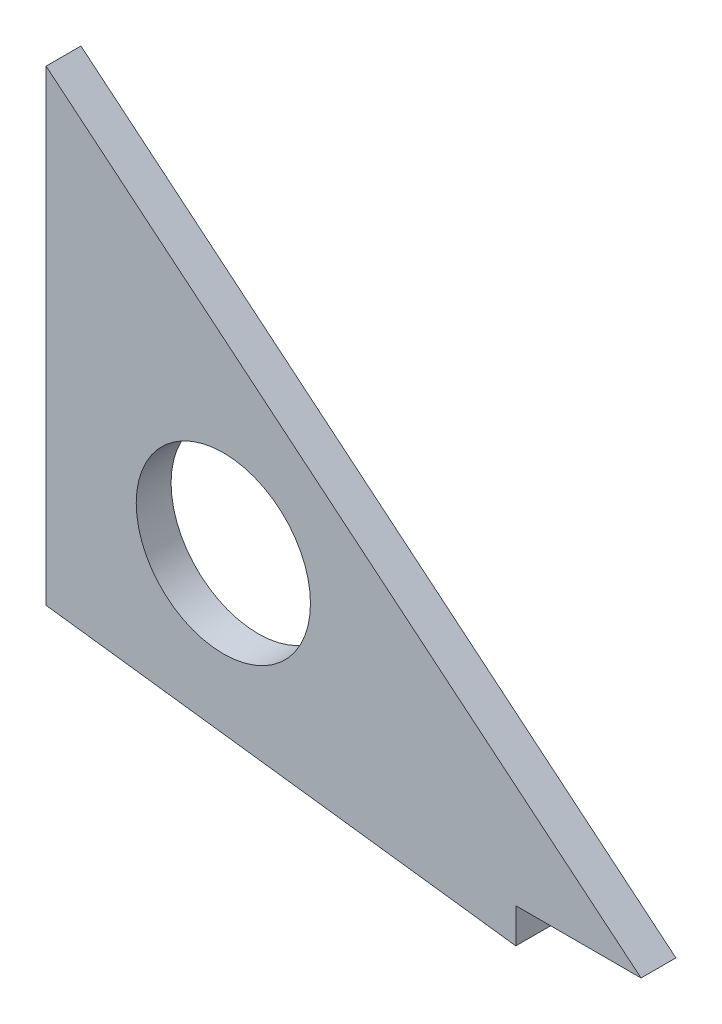
from build123d import *

# Parameters (mm, degrees)
MODEL_R         = 5
EXTRUDE_1_DEPTH = 2


with BuildPart() as part:
    # Model → 凸台-拉伸1 (new body)
    with BuildSketch(Plane.XY):
        Polygon((24.874900003, 9.645447651), (24.874900003, 36.44850036), (59.022431888, 8.19710036), (51.832931888, 8.19710036), (51.832931888, 6.19710036), align=None)
        with Locations((35.047771048, 17.320438646)):
            Circle(MODEL_R, mode=Mode.SUBTRACT)
    extrude(amount=EXTRUDE_1_DEPTH)


solid = part.part
